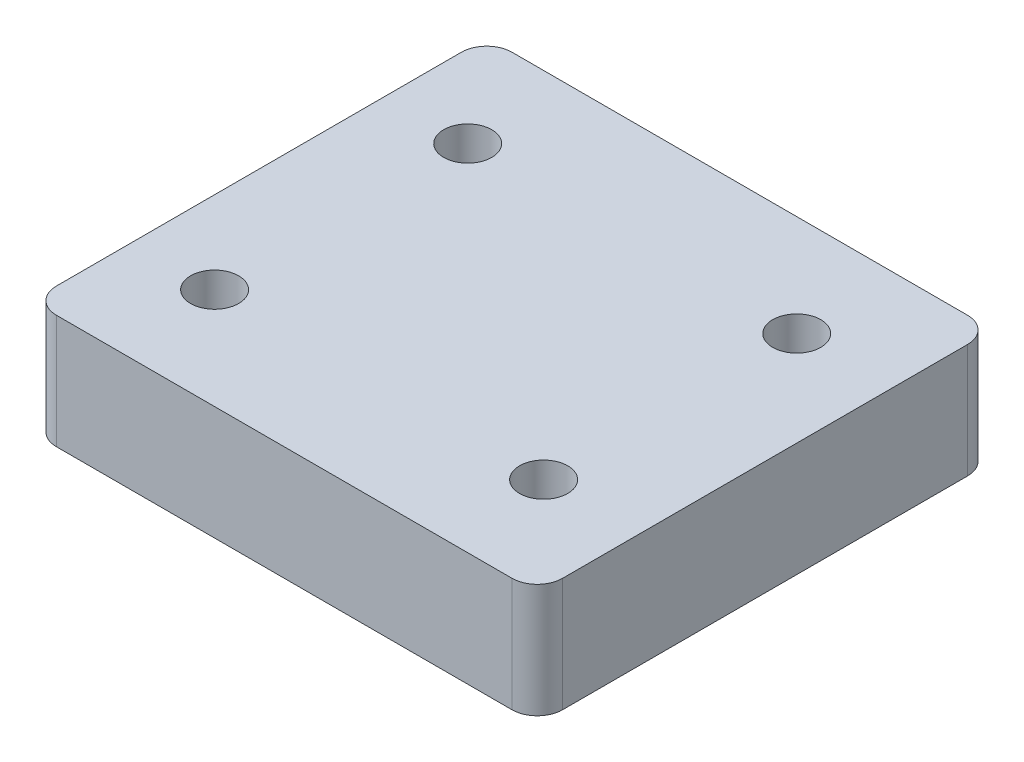
from build123d import *

# Parameters (mm, degrees)
SKETCH1_W           = 40
SKETCH1_H           = 36
BOSS_EXTRUDE1_DEPTH = 9
SKETCH2_R           = 1.9
CUT_EXTRUDE1_DEPTH  = 10
FILLET1_R           = 2


with BuildPart() as part:
    # Sketch1 → Boss-Extrude1 (new body)
    with BuildSketch(Plane(origin=(0, 0, 0), x_dir=(1, 0, 0), z_dir=(0, 1, 0))):
        with Locations((9.482291419, -1.319229855)):
            Rectangle(SKETCH1_W, SKETCH1_H)
    extrude(amount=BOSS_EXTRUDE1_DEPTH)

    # Sketch2 → Cut-Extrude1 (cut)
    with BuildSketch(Plane(origin=(0, 9, 0), x_dir=(1, 0, 0), z_dir=(0, 1, 0))):
        with Locations(Location((-4.017708581, -11.319229855, 0), (0, 0, 270))):
            Circle(SKETCH2_R)
        with Locations(Location((21.982291419, -11.319229855, 0), (0, 0, 270))):
            Circle(SKETCH2_R)
        with Locations(Location((-4.017708581, 8.680770145, 0), (0, 0, 270))):
            Circle(SKETCH2_R)
        with Locations(Location((21.982291419, 8.680770145, 0), (0, 0, 270))):
            Circle(SKETCH2_R)
    extrude(amount=-CUT_EXTRUDE1_DEPTH, mode=Mode.SUBTRACT)

    # Fillet1
    fillet1_edges = [part.edges().sort_by_distance(p)[0] for p in [
        (-10.517708581, 4.5, -16.680770145),
        (29.482291419, 4.5, -16.680770145),
        (29.482291419, 4.5, 19.319229855),
        (-10.517708581, 4.5, 19.319229855),
    ]]
    fillet(fillet1_edges, radius=FILLET1_R)


solid = part.part
